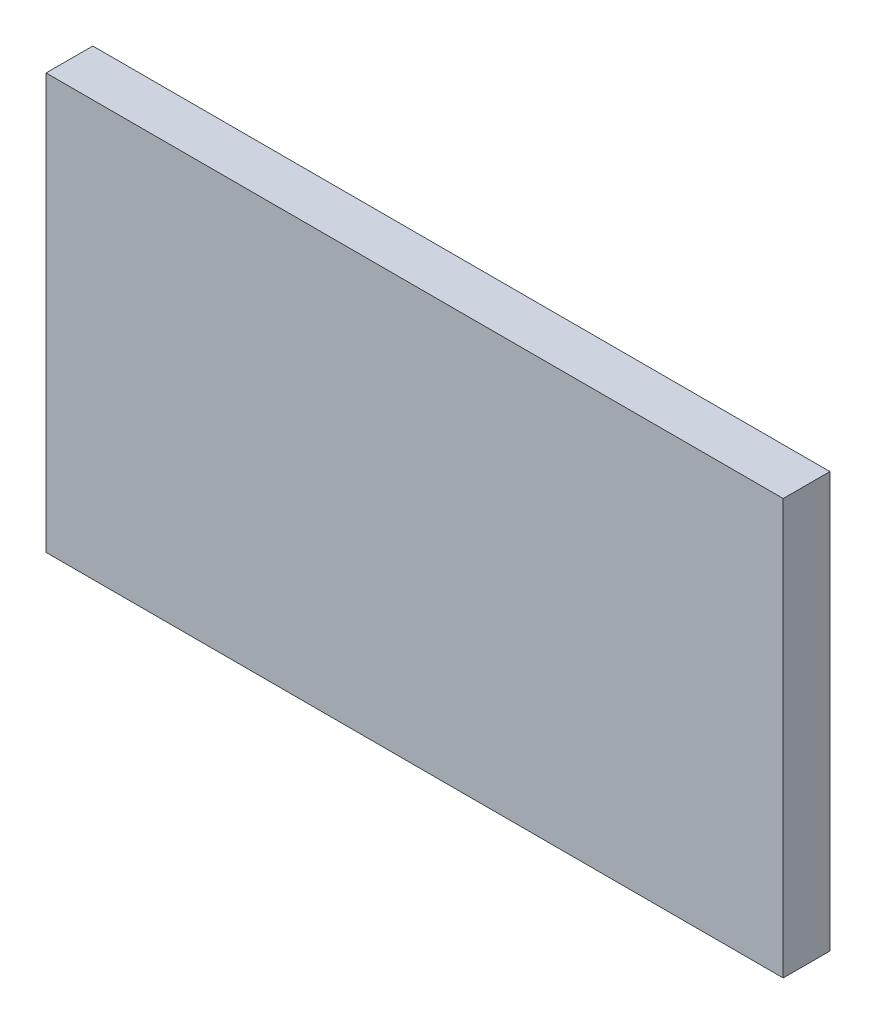
from build123d import *

# Parameters (mm, degrees)
SKETCH1_W           = 76.2
SKETCH1_H           = 42.926
BOSS_EXTRUDE1_DEPTH = 4.826


with BuildPart() as part:
    # Sketch1 → Boss-Extrude1 (new body)
    with BuildSketch(Plane.XY):
        with Locations((38.1, 21.463)):
            Rectangle(SKETCH1_W, SKETCH1_H)
    extrude(amount=BOSS_EXTRUDE1_DEPTH)


solid = part.part
